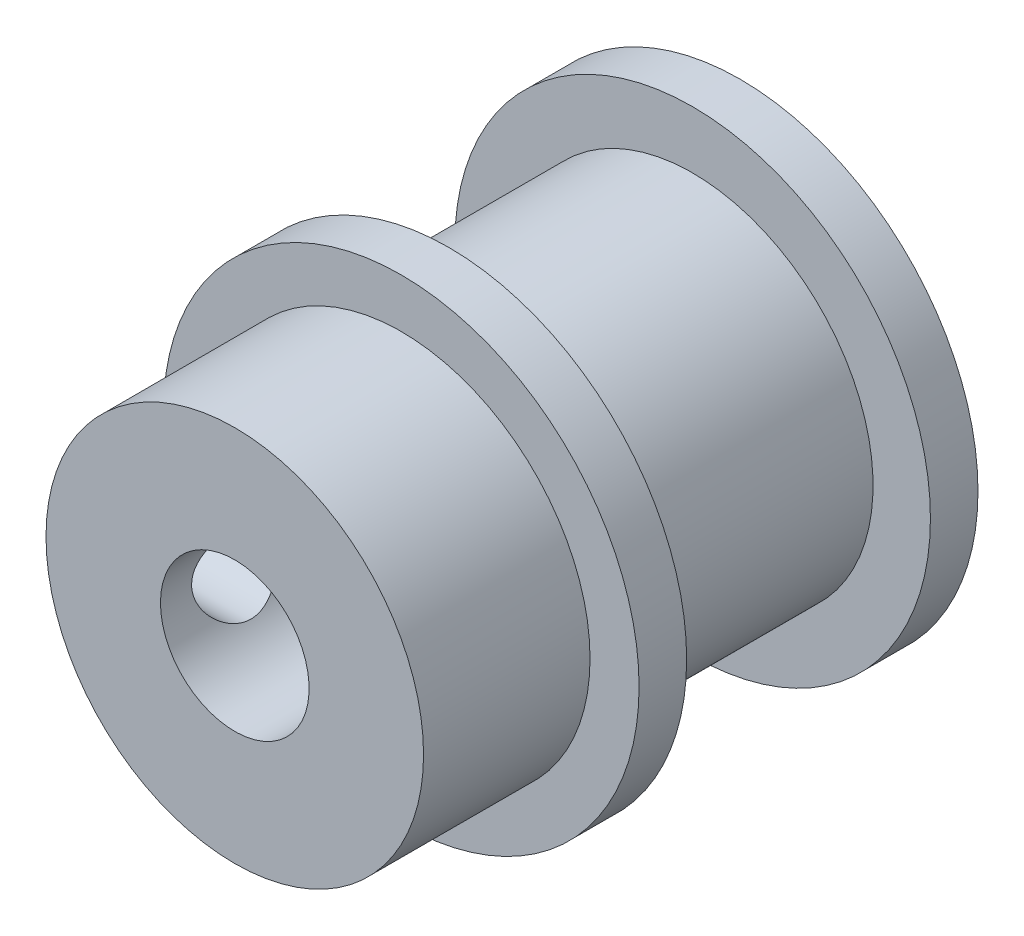
from build123d import *

# Parameters (mm, degrees)
SKETCH1_R                     = 8
BOSS_EXTRUDE1_DEPTH           = 1.6
SKETCH2_R                     = 6.07
BOSS_EXTRUDE2_DEPTH           = 8.2
BOSS_EXTRUDE3_START           = -1.6
SKETCH3_R                     = 8
BOSS_EXTRUDE3_DEPTH           = 1.6
SKETCH4_R                     = 6.35
BOSS_EXTRUDE4_DEPTH           = 5.6
F_5_0_5_DIAMETER_HOLE1_D      = 5
F_3_0_3_DIAMETER_HOLE1_REACH  = 23.882
F_3_0_3_DIAMETER_HOLE1_BORE_R = 1.5


with BuildPart() as part:
    # Sketch1 → Boss-Extrude1 (new body)
    with BuildSketch(Plane.XY.offset(1.6)):
        with Locations(Location((0, 0, 0), (0, 0, 180))):
            Circle(SKETCH1_R)
    extrude(amount=-BOSS_EXTRUDE1_DEPTH)

    # Sketch2 → Boss-Extrude2 (add)
    with BuildSketch(Plane.XY.offset(9.8)):
        with Locations(Location((0, 0, 0), (0, 0, 180))):
            Circle(SKETCH2_R)
    extrude(amount=-BOSS_EXTRUDE2_DEPTH)

    # Sketch3 → Boss-Extrude3 (add)
    with BuildSketch(Plane(origin=(0, 0, 9.8), x_dir=(-1, 0, 0), z_dir=(0, 0, -1)).offset(BOSS_EXTRUDE3_START)):
        Circle(SKETCH3_R)
    extrude(amount=BOSS_EXTRUDE3_DEPTH)

    # Sketch4 → Boss-Extrude4 (add)
    with BuildSketch(Plane.XY.offset(17)):
        Circle(SKETCH4_R)
    extrude(amount=-BOSS_EXTRUDE4_DEPTH)

    # Ø5.0 (5) Diameter Hole1 (through all)
    with Locations(Plane(origin=(0, 0, 0), x_dir=(-1, 0, 0), z_dir=(0, 0, -1))):
        with Locations((0, 0)):
            Hole(F_5_0_5_DIAMETER_HOLE1_D / 2)

    # Ø3.0 (3) Diameter Hole1 bore (on position points) → Ø3.0 (3) Diameter Hole1 (cut, up to next)
    with BuildSketch(Plane(origin=(-6.35, 0, 14.452836514), x_dir=(0, -1, 0), z_dir=(-1, 0, 0)), mode=Mode.PRIVATE) as f_3_0_3_diameter_hole1_sk1:
        Circle(F_3_0_3_DIAMETER_HOLE1_BORE_R)
    f_3_0_3_diameter_hole1_tool1 = extrude(f_3_0_3_diameter_hole1_sk1.sketch, amount=-F_3_0_3_DIAMETER_HOLE1_REACH, mode=Mode.PRIVATE) & part.part
    add(f_3_0_3_diameter_hole1_tool1.solids().sort_by_distance((-6.35, 0, 14.452837))[0], mode=Mode.SUBTRACT)


solid = part.part
